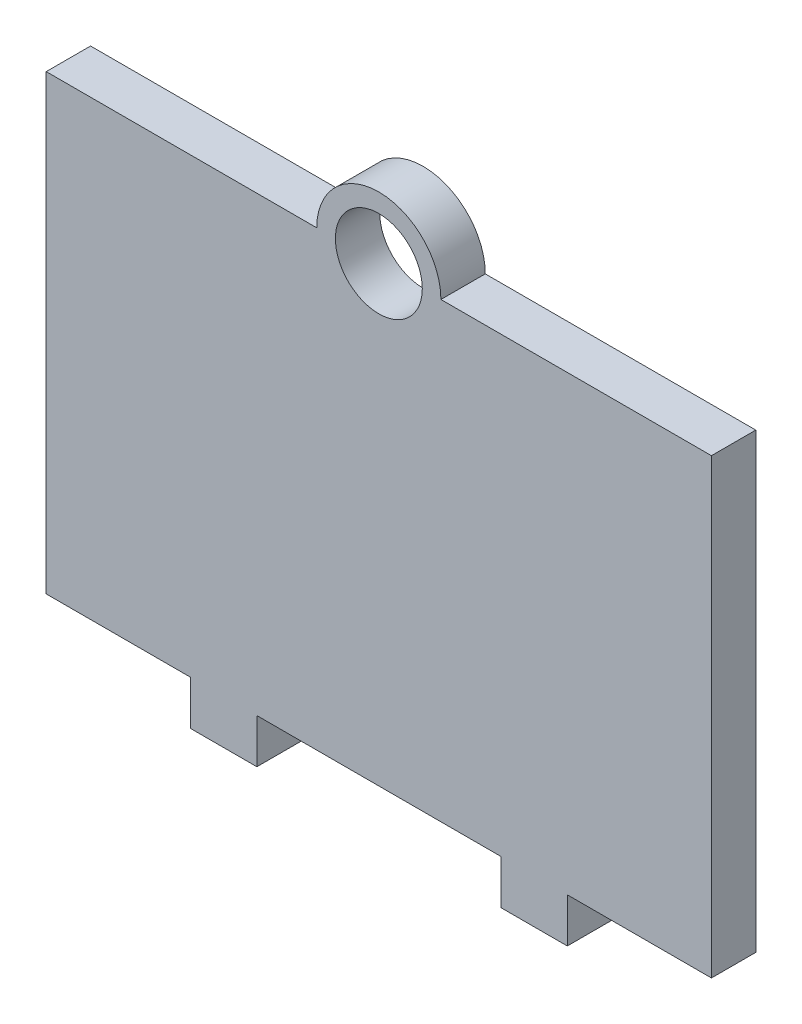
from build123d import *

# Parameters (mm, degrees)
SKETCH1_R      = 12.446
EXTRUDE1_DEPTH = 12.7


with BuildPart() as part:
    # Sketch1 → Extrude1 (new body)
    with BuildSketch(Plane.XY):
        with BuildLine():
            Line((-95.25, 142.24), (-17.78, 142.24))
            ThreePointArc((-17.78, 142.24), (0, 160.02), (17.78, 142.24))
            Line((17.78, 142.24), (95.25, 142.24))
            Line((95.25, 142.24), (95.25, 12.7))
            Line((95.25, 12.7), (53.975, 12.7))
            Line((53.975, 12.7), (53.975, 0))
            Line((53.975, 0), (34.925, 0))
            Line((34.925, 0), (34.925, 12.7))
            Line((34.925, 12.7), (-34.925, 12.7))
            Line((-34.925, 12.7), (-34.925, 0))
            Line((-34.925, 0), (-53.975, 0))
            Line((-53.975, 0), (-53.975, 12.7))
            Line((-53.975, 12.7), (-95.25, 12.7))
            Line((-95.25, 12.7), (-95.25, 142.24))
        make_face()
        with Locations((0, 142.24)):
            Circle(SKETCH1_R, mode=Mode.SUBTRACT)
    extrude(amount=-EXTRUDE1_DEPTH)


solid = part.part
